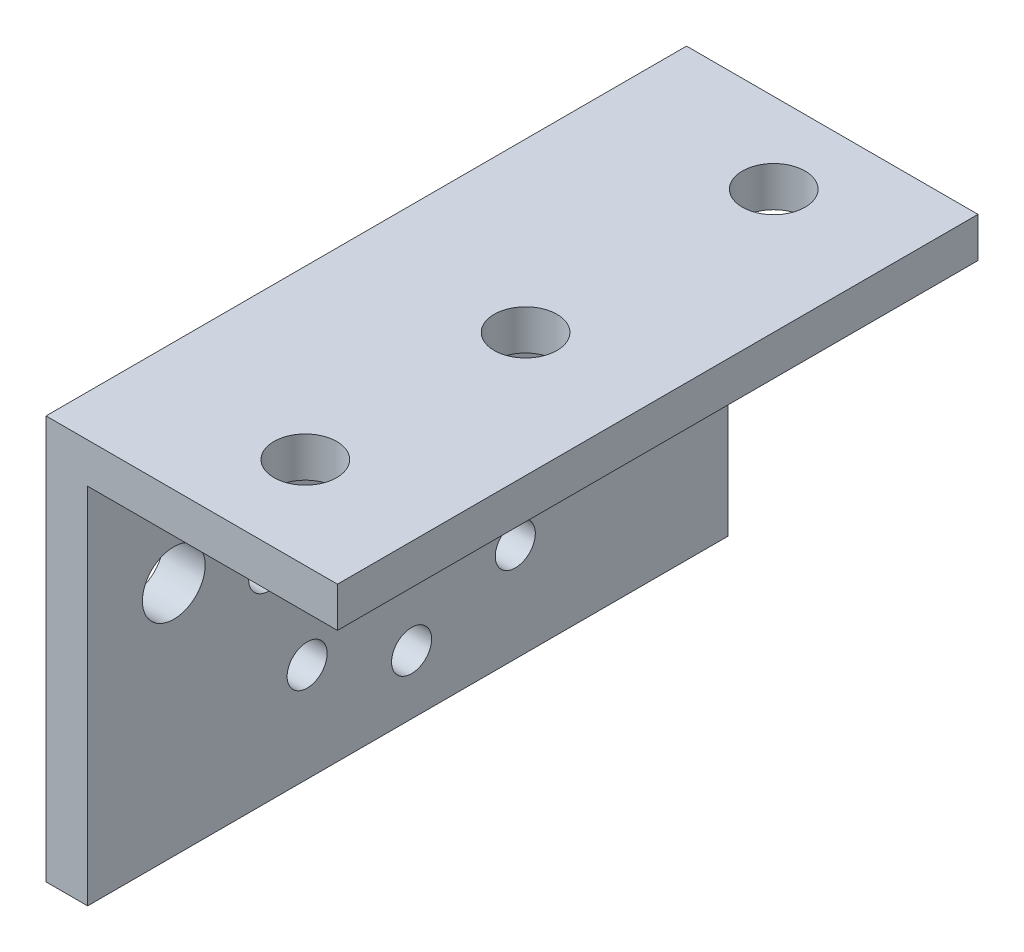
from build123d import *

# Parameters (mm, degrees)
BOSS_EXTRUDE1_DEPTH              = 50.8
F_9_0_196_DIAMETER_HOLE2_D       = 4.9784
F_9_0_196_DIAMETER_HOLE3_D       = 4.9784
F_1_8_0_125_DIAMETER_HOLE1_D     = 3.175
F_1_8_0_125_DIAMETER_HOLE1_DEPTH = 3.302


with BuildPart() as part:
    # Sketch1 → Boss-Extrude1 (new body)
    with BuildSketch(Plane.XY):
        Polygon((0, 0), (0, 32.004), (23.114, 32.004), (23.114, 28.829), (3.302, 28.829), (3.302, 0), align=None)
    extrude(amount=BOSS_EXTRUDE1_DEPTH)

    # #9 (0.196) Diameter Hole2 (through all)
    with Locations(Plane(origin=(0, 32.004, 0), x_dir=(1, 0, 0), z_dir=(0, 1, 0))):
        with Locations((13.280812395, -26.046570346), (13.280812395, -6.366207965), (13.280812395, -43.514069015)):
            Hole(F_9_0_196_DIAMETER_HOLE2_D / 2)

    # #9 (0.196) Diameter Hole3 (through all)
    with Locations(Plane.ZY):
        with Locations((6.2896856, 18.761683292), (26.205635925, 18.761683292), (43.966936654, 18.761683292)):
            Hole(F_9_0_196_DIAMETER_HOLE3_D / 2)

    # 1/8 (0.125) Diameter Hole1
    with Locations(Plane.ZY):
        with Locations((36.442896127, 16.028307276), (33.392991473, 7.842756721), (25.109056897, 4.694468046), (16.884152733, 7.842756721), (13.794894471, 16.028307276), (16.884152733, 24.292565048), (25.109056897, 27.362146507), (33.392991473, 24.292565048)):
            Hole(F_1_8_0_125_DIAMETER_HOLE1_D / 2, depth=F_1_8_0_125_DIAMETER_HOLE1_DEPTH)


solid = part.part
